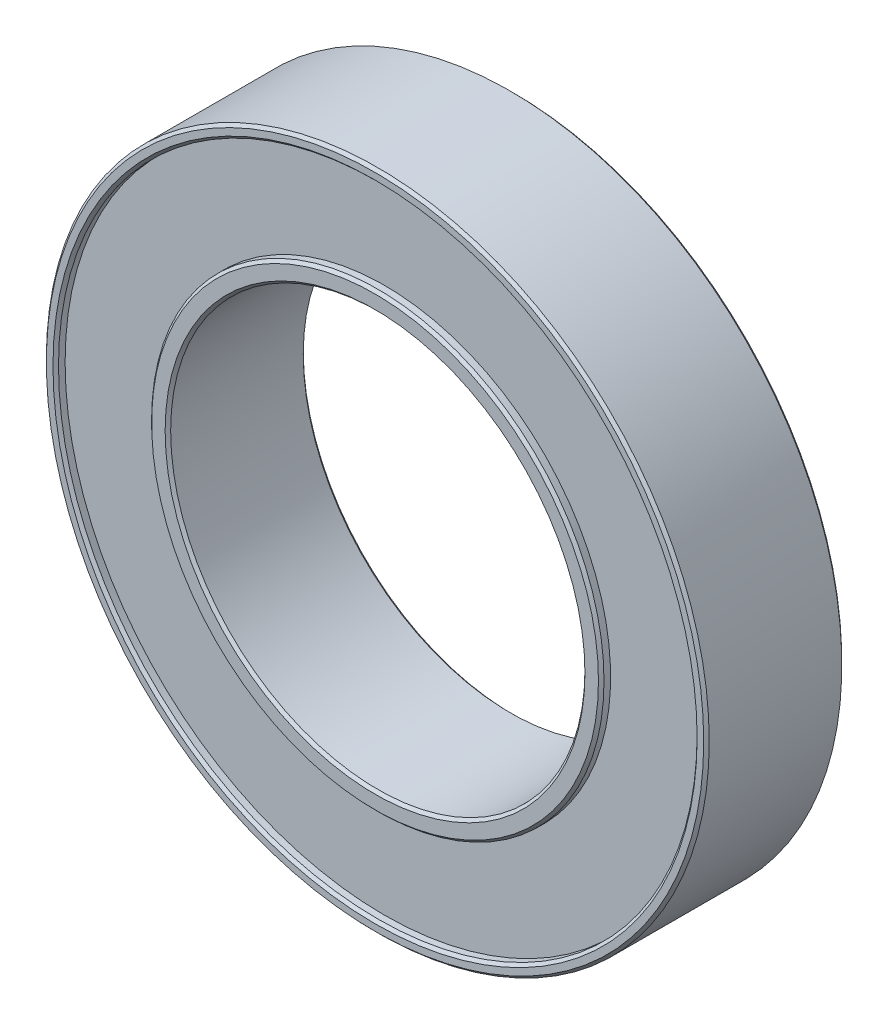
from build123d import *

# Parameters (mm, degrees)
CHAMFER1_SIZE = 0.1


with BuildPart() as part:
    # Sketch1 → Revolve1 (revolve)
    with BuildSketch(Plane(origin=(0, 0, 0), x_dir=(0, 0, -1), z_dir=(1, 0, 0)), mode=Mode.PRIVATE) as revolve1_sk:
        Polygon((-2.5, 12), (2.5, 12), (2.5, 11.56094363), (2.160325371, 11.56094363), (2.160325371, 8.189433036), (2.5, 8.189433036), (2.5, 7.5), (-2.5, 7.5), (-2.5, 8.189433036), (-2.160325371, 8.189433036), (-2.160325371, 11.56094363), (-2.5, 11.56094363), align=None)
    revolve(revolve1_sk.sketch.rotate(Axis((0, 0, -19.078271996), (0, 0, 1)), 90), axis=Axis((0, 0, -19.078271996), (0, 0, 1)))

    # Chamfer1
    chamfer1_edges = [part.edges().sort_by_distance(p)[0] for p in [
        (11.56094363, 0, 2.5),
        (12, 0, 2.5),
        (12, 0, -2.5),
        (11.56094363, 0, -2.5),
        (8.189433036, 0, -2.5),
        (7.5, 0, -2.5),
        (7.5, 0, 2.5),
        (8.189433036, 0, 2.5),
    ]]
    chamfer(chamfer1_edges, length=CHAMFER1_SIZE)


solid = part.part
